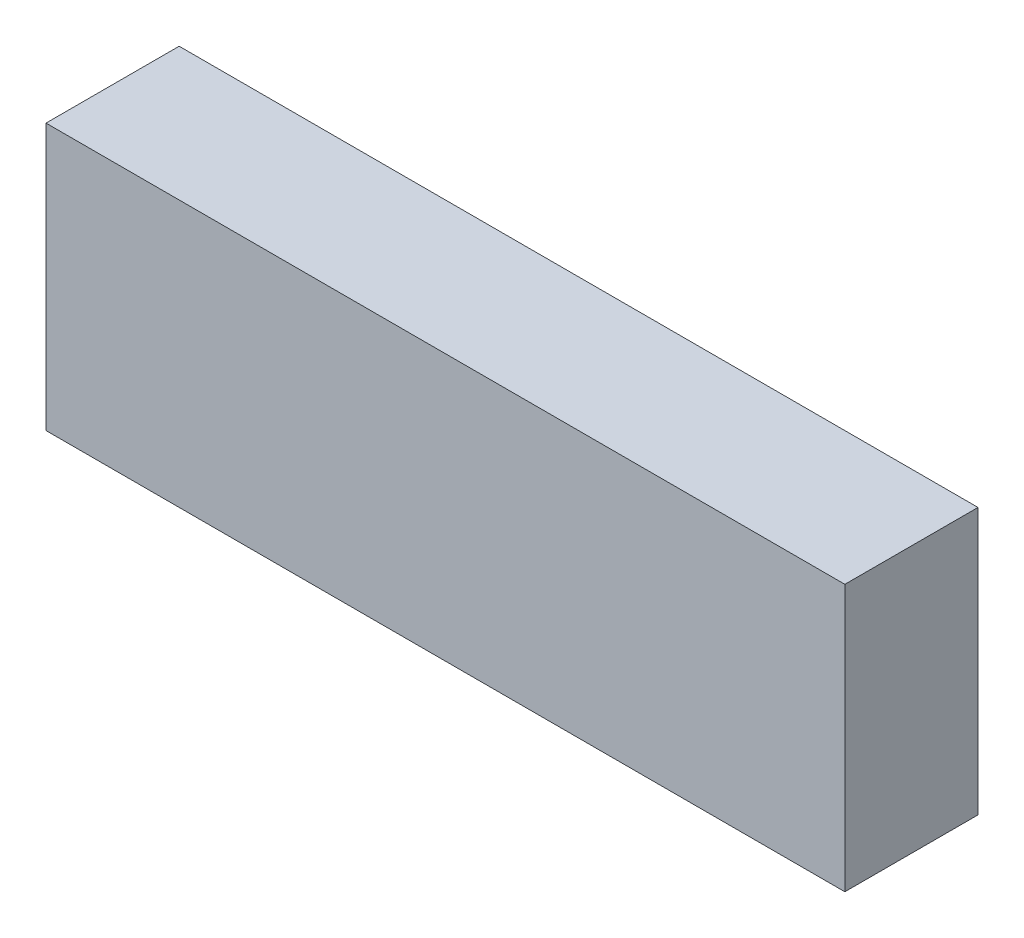
from build123d import *

# Parameters (mm, degrees)
SKETCH1_W           = 152.4
SKETCH1_H           = 50.8
BOSS_EXTRUDE1_DEPTH = 25.4


with BuildPart() as part:
    # Sketch1 → Boss-Extrude1 (new body)
    with BuildSketch(Plane.XY):
        Rectangle(SKETCH1_W, SKETCH1_H)
    extrude(amount=BOSS_EXTRUDE1_DEPTH)


solid = part.part
